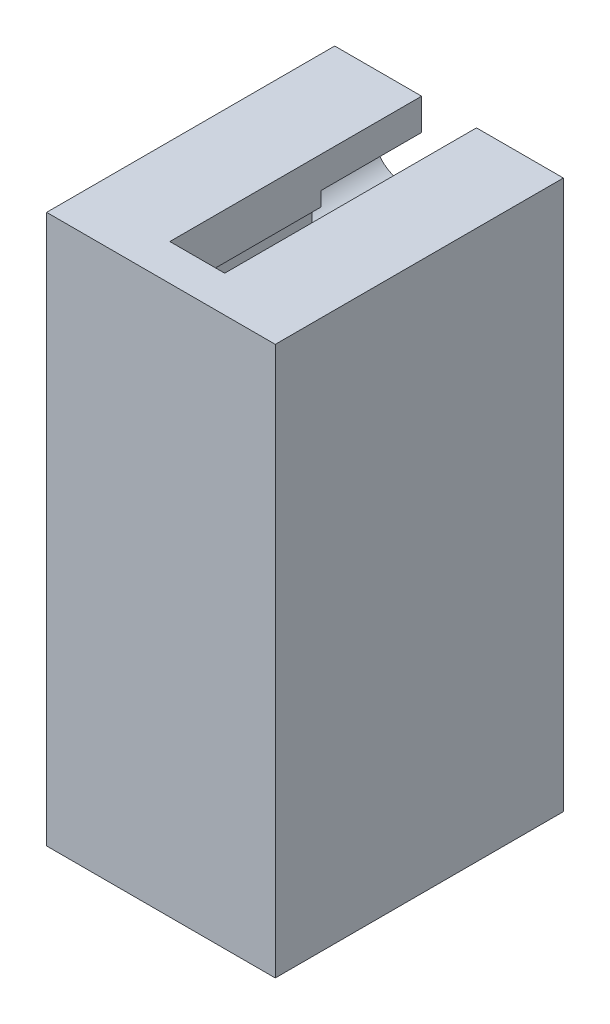
from build123d import *

# Parameters (mm, degrees)
SKETCH1_W           = 31.5
SKETCH1_H           = 60
BOSS_EXTRUDE1_DEPTH = 12.5
CUT_EXTRUDE1_DEPTH  = 27.53
SKETCH6_R           = 3.25
CUT_EXTRUDE2_DEPTH  = 11


with BuildPart() as part:
    # Sketch1 → Boss-Extrude1 (new, symmetric)
    with BuildSketch(Plane(origin=(0, 0, 0), x_dir=(0, 0, -1), z_dir=(1, 0, 0))):
        with Locations((15.75, 20)):
            Rectangle(SKETCH1_W, SKETCH1_H)
    extrude(amount=BOSS_EXTRUDE1_DEPTH, both=True)

    # Sketch2 → Cut-Extrude1 (cut)
    with BuildSketch(Plane(origin=(0, 0, -31.5), x_dir=(-1, 0, 0), z_dir=(0, 0, -1))):
        Polygon((10.015, -0.015), (10.015, 40.015), (4, 40.015), (4, 45), (3, 45), (3, 50), (-3, 50), (-3, 45), (-4, 45), (-4, 40.015), (-10.015, 40.015), (-10.015, -0.015), align=None)
    extrude(amount=-CUT_EXTRUDE1_DEPTH, mode=Mode.SUBTRACT)

    # Sketch6 → Cut-Extrude2 (cut)
    with BuildSketch(Plane(origin=(0, 0, -31.5), x_dir=(-1, 0, 0), z_dir=(0, 0, -1))):
        with Locations((-5, 44)):
            Circle(SKETCH6_R)
        with Locations((5, 44)):
            Circle(SKETCH6_R)
        with Locations((5, -4)):
            Circle(SKETCH6_R)
        with Locations((-5, -4)):
            Circle(SKETCH6_R)
    extrude(amount=-CUT_EXTRUDE2_DEPTH, mode=Mode.SUBTRACT)


solid = part.part
